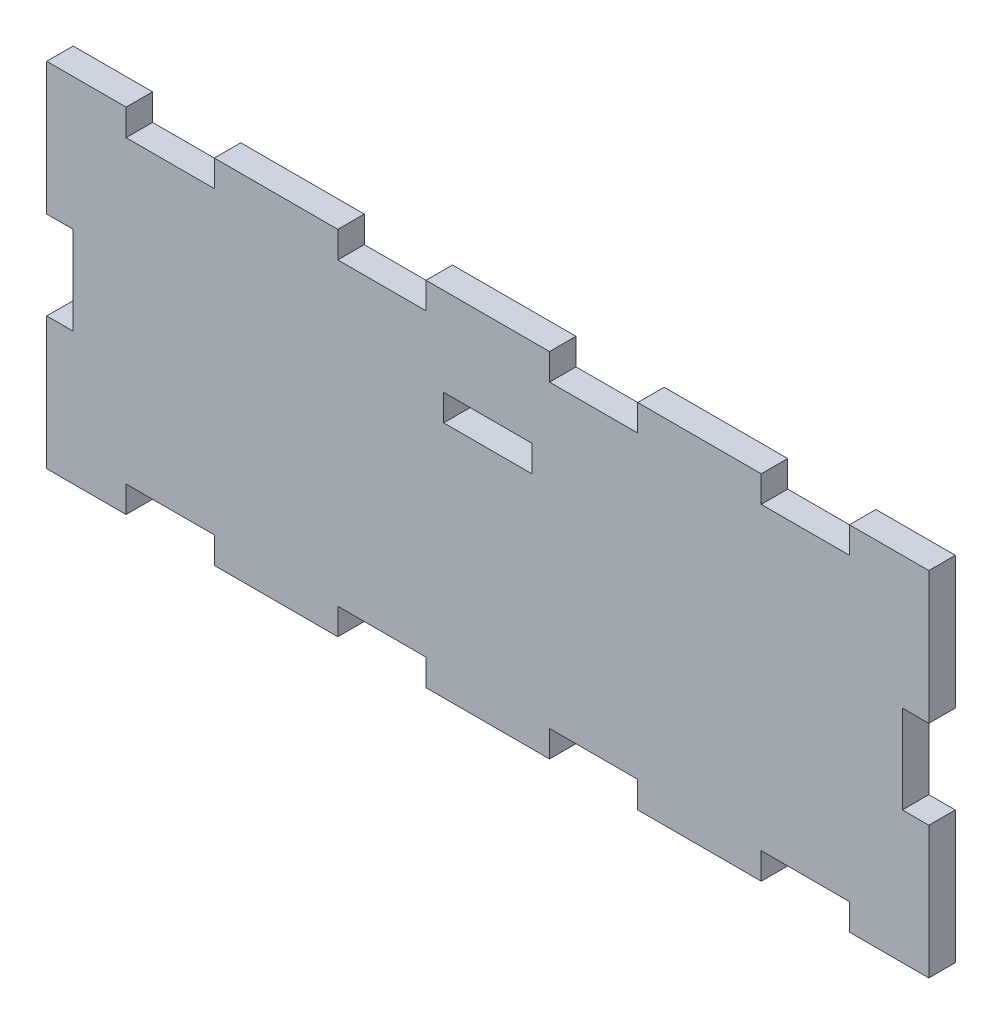
from build123d import *

# Parameters (mm, degrees)
EXTRUDE_1_DEPTH     = 3
SKETCH_2_W          = 10
SKETCH_2_H          = 3
CUT_EXTRUDE_1_DEPTH = 3


with BuildPart() as part:
    # 草圖1 → 填料-伸長1 (new body)
    with BuildSketch(Plane.XY):
        Polygon((49.262888429, -24.540240663), (49.262888429, -21.540240663), (39.262888429, -21.540240663), (39.262888429, -24.540240663), (25.262888429, -24.540240663), (25.262888429, -21.540240663), (15.262888429, -21.540240663), (15.262888429, -24.540240663), (1.262888429, -24.540240663), (1.262888429, -21.540240663), (-8.737111571, -21.540240663), (-8.737111571, -24.540240663), (-22.737111571, -24.540240663), (-22.737111571, -21.540240663), (-32.737111571, -21.540240663), (-32.737111571, -24.540240663), (-41.737111571, -24.540240663), (-41.737111571, -9.540240663), (-38.737111571, -9.540240663), (-38.737111571, 0.459759337), (-41.737111571, 0.459759337), (-41.737111571, 15.459759337), (-32.737111571, 15.459759337), (-32.737111571, 12.459759337), (-22.737111571, 12.459759337), (-22.737111571, 15.459759337), (-8.737111571, 15.459759337), (-8.737111571, 12.459759337), (1.262888429, 12.459759337), (1.262888429, 15.459759337), (15.262888429, 15.459759337), (15.262888429, 12.459759337), (25.262888429, 12.459759337), (25.262888429, 15.459759337), (39.262888429, 15.459759337), (39.262888429, 12.459759337), (49.262888429, 12.459759337), (49.262888429, 15.459759337), (58.262888429, 15.459759337), (58.262888429, 0.459759337), (55.262888429, 0.459759337), (55.262888429, -9.540240663), (58.262888429, -9.540240663), (58.262888429, -24.540240663), align=None)
    extrude(amount=EXTRUDE_1_DEPTH)

    # 草圖2 → 除料-伸長1 (cut)
    with BuildSketch(Plane.XY.offset(3)):
        with Locations((8.262888429, 3.959759337)):
            Rectangle(SKETCH_2_W, SKETCH_2_H)
    extrude(amount=-CUT_EXTRUDE_1_DEPTH, mode=Mode.SUBTRACT)


solid = part.part
